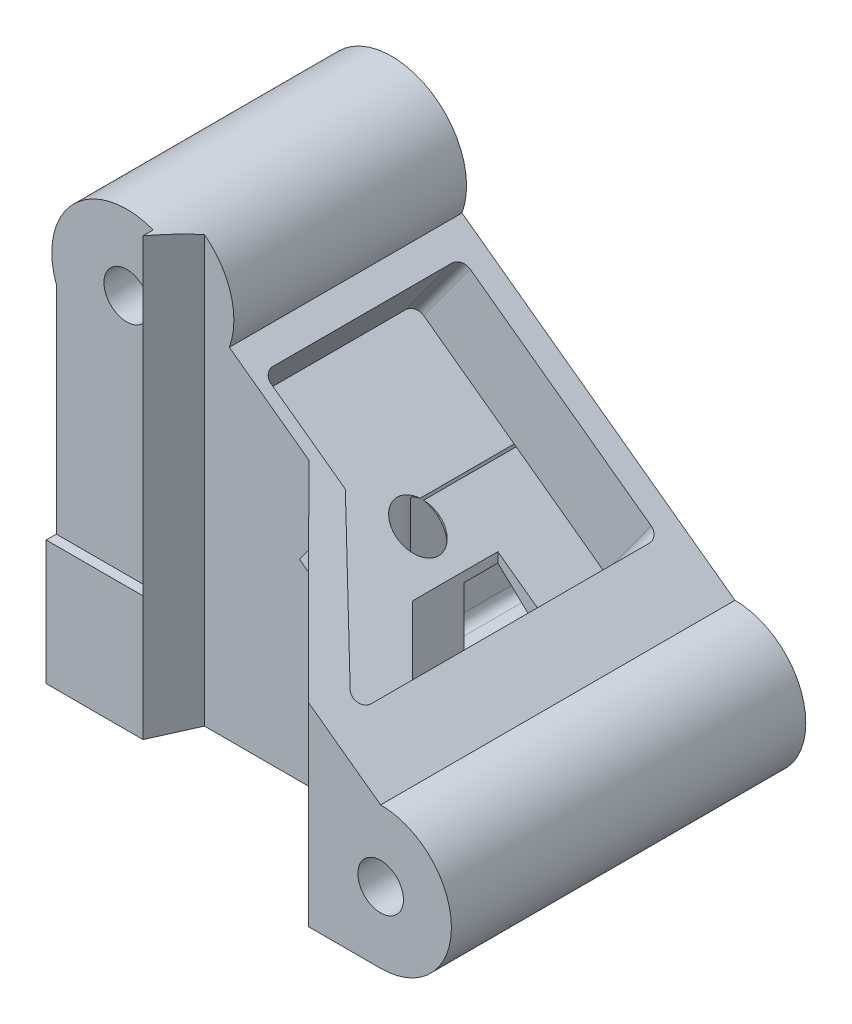
from build123d import *

# Parameters (mm, degrees)
EXTRUDE_2_DEPTH      = 70
SKETCH_2_R           = 4.5
CUT_EXTRUDE_1_DEPTH  = 137.328904374
SKETCH_3_R           = 4.090160499
CUT_EXTRUDE_6_DEPTH  = 148.155778511
CUT_EXTRUDE_7_DEPTH  = 39
CUT_EXTRUDE_8_DEPTH  = 24
CUT_EXTRUDE_10_DEPTH = 15.54553
SKETCH_8_W           = 23.69290401
SKETCH_8_H           = 65.223291357
CUT_EXTRUDE_17_DEPTH = 2
SKETCH_11_W          = 20.993509015
SKETCH_11_H          = 16.846387944
CUT_EXTRUDE_18_DEPTH = 32


with BuildPart() as part:
    # 草图1 → 凸台-拉伸2 (new body)
    with BuildSketch(Plane.XY):
        with BuildLine():
            Line((81.732708287, -39.29625786), (27.802988829, 0))
            ThreePointArc((27.802988829, 0), (13.901494414, 19.878364925), (0, 0))
            Line((0, 0), (0, -67.261658581))
            Line((0, -67.261658581), (81.732708287, -67.261658581))
            ThreePointArc((81.732708287, -67.261658581), (95.715408648, -53.278958221), (81.732708287, -39.29625786))
        make_face()
    extrude(amount=EXTRUDE_2_DEPTH)

    # 草图2 → 切除-拉伸1 (cut, through all)
    with BuildSketch(Plane.XY.offset(70)):
        with Locations((13.901494414, 5.078331289)):
            Circle(SKETCH_2_R)
        with Locations((81.732708287, -53.278958221)):
            Circle(SKETCH_2_R)
    extrude(amount=-CUT_EXTRUDE_1_DEPTH, mode=Mode.SUBTRACT)

    # 草图3 → 切除-拉伸6 (cut, through all)
    with BuildSketch(Plane.XZ.offset(67.261658581)):
        Polygon((0, 70), (0, 54.327744823), (19.127903804, 54.327744823), (22.885447911, 45.957752642), (43.508217671, 45.957752642), (67.470579189, 70), align=None)
        with Locations(Location((45.17973926, 26.08521819, 0), (0, 0, 270))):
            Circle(SKETCH_3_R)
        Polygon((52.23727486, 17.356161), (52.23727486, 34.257101516), (63.937925986, 45.957752642), (69.138215376, 45.957752642), (69.138215376, 17.356161), align=None)
    extrude(amount=-CUT_EXTRUDE_6_DEPTH, mode=Mode.SUBTRACT)

    # 草图4 → 切除-拉伸7 (cut)
    with BuildSketch(Plane.XZ.offset(67.261658581)):
        Polygon((22.885447911, 8.627103811), (18.401494414, 0), (34.441291314, 0), (31.064668061, 2.444179202), (31.064668061, 8.627103811), align=None)
    extrude(amount=-CUT_EXTRUDE_7_DEPTH, mode=Mode.SUBTRACT)

    # 草图5 → 切除-拉伸8 (cut)
    with BuildSketch(Plane(origin=(0, 0, 0), x_dir=(-1, 0, 0), z_dir=(0, 0, -1))):
        with BuildLine():
            Line((-41.542727958, -58.835532646), (-60.755117779, -58.835532646))
            ThreePointArc((-60.755117779, -58.835532646), (-65.404539499, -55.674792736), (-64.175716102, -50.188683717))
            Line((-64.175716102, -50.188683717), (-42.910967287, -30.243200498))
            ThreePointArc((-42.910967287, -30.243200498), (-40.74789422, -29.866663707), (-39.542727958, -31.70194007))
            Line((-39.542727958, -31.70194007), (-39.542727958, -56.835532646))
            ThreePointArc((-39.542727958, -56.835532646), (-40.128514395, -58.249746209), (-41.542727958, -58.835532646))
        make_face()
    extrude(amount=-CUT_EXTRUDE_8_DEPTH, mode=Mode.SUBTRACT)

    # 草图6 → 切除-拉伸10 (cut)
    with BuildSketch(Plane(origin=(9.642267302, 13.232933589, 0), x_dir=(0.8082036490143236, -0.5889031004502626, 0), z_dir=(0.5889031004502626, 0.8082036490143236, 0))):
        with BuildLine():
            Line((29.890061059, -4.403507587), (74.147943401, -4.403507587))
            ThreePointArc((74.147943401, -4.403507587), (75.562156964, -4.989294025), (76.147943401, -6.403507587))
            Line((76.147943401, -6.403507587), (76.147943401, -61.283822566))
            ThreePointArc((76.147943401, -61.283822566), (75.03106335, -63.078286039), (72.927844245, -62.868549057))
            Line((72.927844245, -62.868549057), (48.038970697, -43.706318979))
            Line((48.038970697, -43.706318979), (29.890061059, -43.706318979))
            ThreePointArc((29.890061059, -43.706318979), (28.475847496, -43.120532542), (27.890061059, -41.706318979))
            Line((27.890061059, -41.706318979), (27.890061059, -6.403507587))
            ThreePointArc((27.890061059, -6.403507587), (28.475847496, -4.989294025), (29.890061059, -4.403507587))
        make_face()
    extrude(amount=-CUT_EXTRUDE_10_DEPTH, mode=Mode.SUBTRACT)

    # 草图8 → 切除-拉伸17 (cut)
    with BuildSketch(Plane.XY.offset(54.327744823)):
        with Locations((7.281451799, -10.065691162)):
            Rectangle(SKETCH_8_W, SKETCH_8_H)
    extrude(amount=-CUT_EXTRUDE_17_DEPTH, mode=Mode.SUBTRACT)


with BuildPart() as cut_extrude_17_piece_1:
    # of the separate pieces the step leaves, piece 1, a body of its own (cut_extrude_17_pieces)
    add(part.part.solids().sort_by_distance((81.732708287, -39.29625786, 0))[0])


with BuildPart() as cut_extrude_17_piece_2:
    # of the separate pieces the step leaves, piece 2, a body of its own (cut_extrude_17_pieces)
    add(part.part.solids().sort_by_distance((0, 0, 54.327744823))[0])

    # 草图11 → 切除-拉伸18 (cut)
    with BuildSketch(Plane(origin=(0, 0, 0), x_dir=(0, 0, -1), z_dir=(1, 0, 0))):
        with Locations((-64.824499331, 8.423193972)):
            Rectangle(SKETCH_11_W, SKETCH_11_H)
    extrude(amount=-CUT_EXTRUDE_18_DEPTH, mode=Mode.SUBTRACT)


solid = cut_extrude_17_piece_1.part
